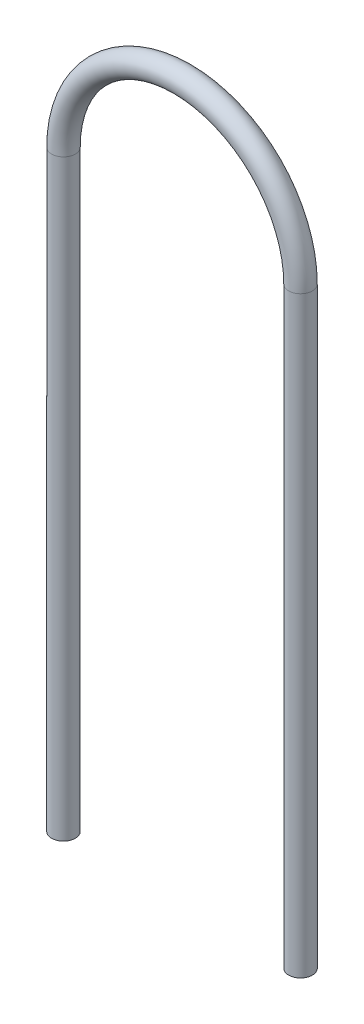
from build123d import *

# Parameters (mm, degrees)
SKETCH2_R = 10


with BuildPart() as part:
    # Sweep1: sweep along a path in Sketch1
    with BuildLine(Plane.XY) as sweep1_path:
        Line((0, 0), (0, 500))
        ThreePointArc((0, 500), (100, 600), (200, 500))
        Line((200, 500), (200, 0))
    # Sketch2 → Sweep1 (sweep)
    with BuildSketch(Plane(origin=(0, 0, 0), x_dir=(1, 0, 0), z_dir=(0, 1, 0))):
        Circle(SKETCH2_R)
    sweep(path=sweep1_path.line)


solid = part.part
